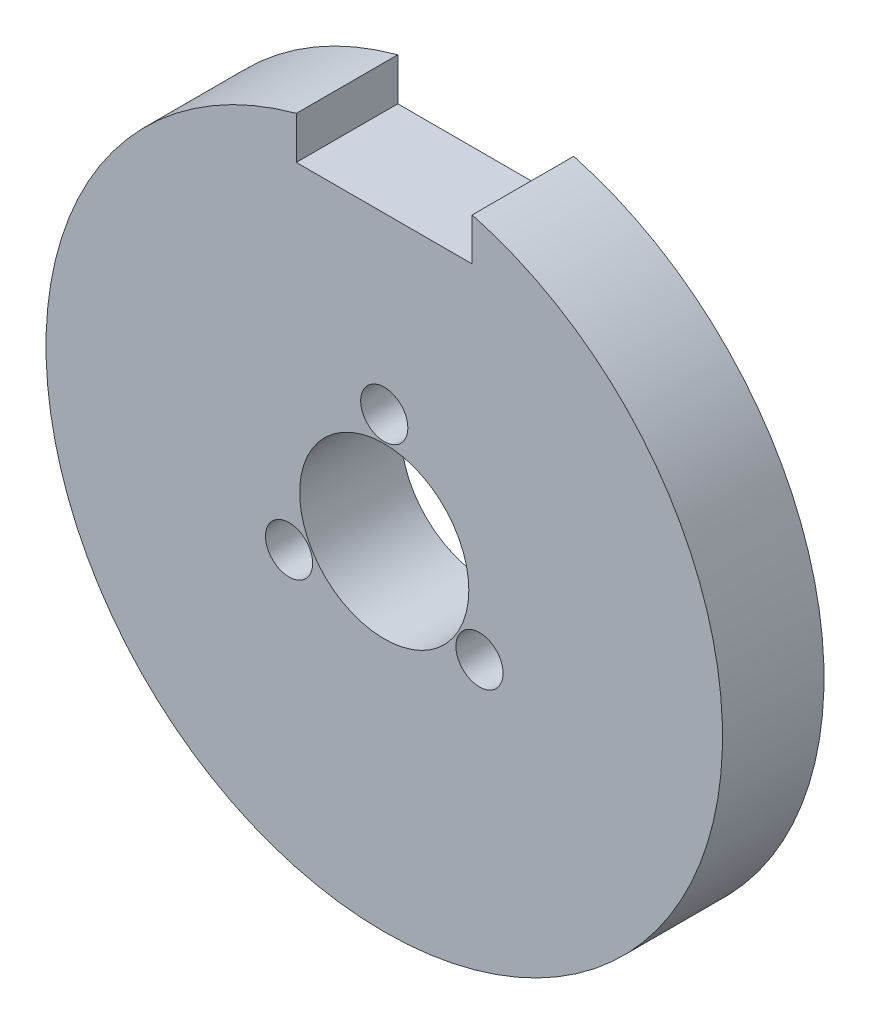
from build123d import *

# Parameters (mm, degrees)
ESQUISSE1_R             = 20
BOSS_EXTRU_1_DEPTH      = 6
ESQUISSE2_R             = 5
ENL_V_MAT_EXTRU_1_DEPTH = 29.91366459
ESQUISSE3_R             = 1.393852397
ENL_V_MAT_EXTRU_2_DEPTH = 29.91366459
ENL_V_MAT_EXTRU_3_DEPTH = 29.91366459


with BuildPart() as part:
    # Esquisse1 → Boss.-Extru.1 (new body)
    with BuildSketch(Plane.XY):
        Circle(ESQUISSE1_R)
    extrude(amount=BOSS_EXTRU_1_DEPTH)

    # Esquisse2 → Enlèv. mat.-Extru.1 (cut, through all)
    with BuildSketch(Plane.XY.offset(6)):
        Circle(ESQUISSE2_R)
    extrude(amount=-ENL_V_MAT_EXTRU_1_DEPTH, mode=Mode.SUBTRACT)

    # Esquisse3 → Enlèv. mat.-Extru.2 (cut, through all)
    with BuildSketch(Plane.XY.offset(6)):
        with Locations((0, 6.5)):
            Circle(ESQUISSE3_R)
        with Locations((5.629165125, -3.25)):
            Circle(ESQUISSE3_R)
        with Locations((-5.629165125, -3.25)):
            Circle(ESQUISSE3_R)
    extrude(amount=-ENL_V_MAT_EXTRU_2_DEPTH, mode=Mode.SUBTRACT)

    # Esquisse4 → Enlèv. mat.-Extru.3 (cut, through all)
    with BuildSketch(Plane(origin=(0, 0, 0), x_dir=(-1, 0, 0), z_dir=(0, 0, -1))):
        with BuildLine():
            Line((5.2, 16.80000003), (5.2, 19.312172327))
            ThreePointArc((5.2, 19.312172327), (0, 20), (-5.2, 19.312172327))
            Line((-5.2, 19.312172327), (-5.2, 16.80000003))
            Line((-5.2, 16.80000003), (5.2, 16.80000003))
        make_face()
    extrude(amount=-ENL_V_MAT_EXTRU_3_DEPTH, mode=Mode.SUBTRACT)


solid = part.part
